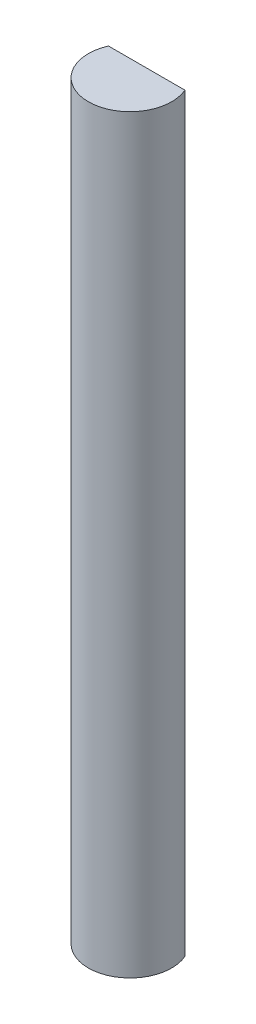
from build123d import *

# Parameters (mm, degrees)
BOSS_EXTRUDE1_DEPTH = 180
SKETCH3_W           = 14
SKETCH3_H           = 6.4
CUT_EXTRUDE1_DEPTH  = 7


with BuildPart() as part:
    # Sketch2 → Boss-Extrude1 (new body)
    with BuildSketch(Plane(origin=(0, 0, 0), x_dir=(1, 0, 0), z_dir=(0, 1, 0))):
        with BuildLine():
            Line((-9.16515139, 4), (9.16515139, 4))
            ThreePointArc((9.16515139, 4), (0, -10), (-9.16515139, 4))
        make_face()
    extrude(amount=BOSS_EXTRUDE1_DEPTH)

    # Sketch3 → Cut-Extrude1 (cut)
    with BuildSketch(Plane(origin=(0, 0, -4), x_dir=(-1, 0, 0), z_dir=(0, 0, -1))):
        with Locations((-0.07756818, 173.8)):
            Rectangle(SKETCH3_W, SKETCH3_H)
        with Locations((-0.07756818, 163.8)):
            Rectangle(SKETCH3_W, SKETCH3_H)
        with Locations((-0.07756818, 153.8)):
            Rectangle(SKETCH3_W, SKETCH3_H)
        with Locations((-0.07756818, 143.8)):
            Rectangle(SKETCH3_W, SKETCH3_H)
        with Locations((-0.07756818, 133.8)):
            Rectangle(SKETCH3_W, SKETCH3_H)
        with Locations((-0.07756818, 123.8)):
            Rectangle(SKETCH3_W, SKETCH3_H)
        with Locations((-0.07756818, 113.8)):
            Rectangle(SKETCH3_W, SKETCH3_H)
        with Locations((-0.07756818, 103.8)):
            Rectangle(SKETCH3_W, SKETCH3_H)
        with Locations((-0.07756818, 93.8)):
            Rectangle(SKETCH3_W, SKETCH3_H)
        with Locations((-0.07756818, 83.8)):
            Rectangle(SKETCH3_W, SKETCH3_H)
        with Locations((-0.07756818, 73.8)):
            Rectangle(SKETCH3_W, SKETCH3_H)
        with Locations((-0.07756818, 63.8)):
            Rectangle(SKETCH3_W, SKETCH3_H)
        with Locations((-0.07756818, 53.8)):
            Rectangle(SKETCH3_W, SKETCH3_H)
        with Locations((-0.07756818, 43.8)):
            Rectangle(SKETCH3_W, SKETCH3_H)
    extrude(amount=-CUT_EXTRUDE1_DEPTH, mode=Mode.SUBTRACT)


solid = part.part
